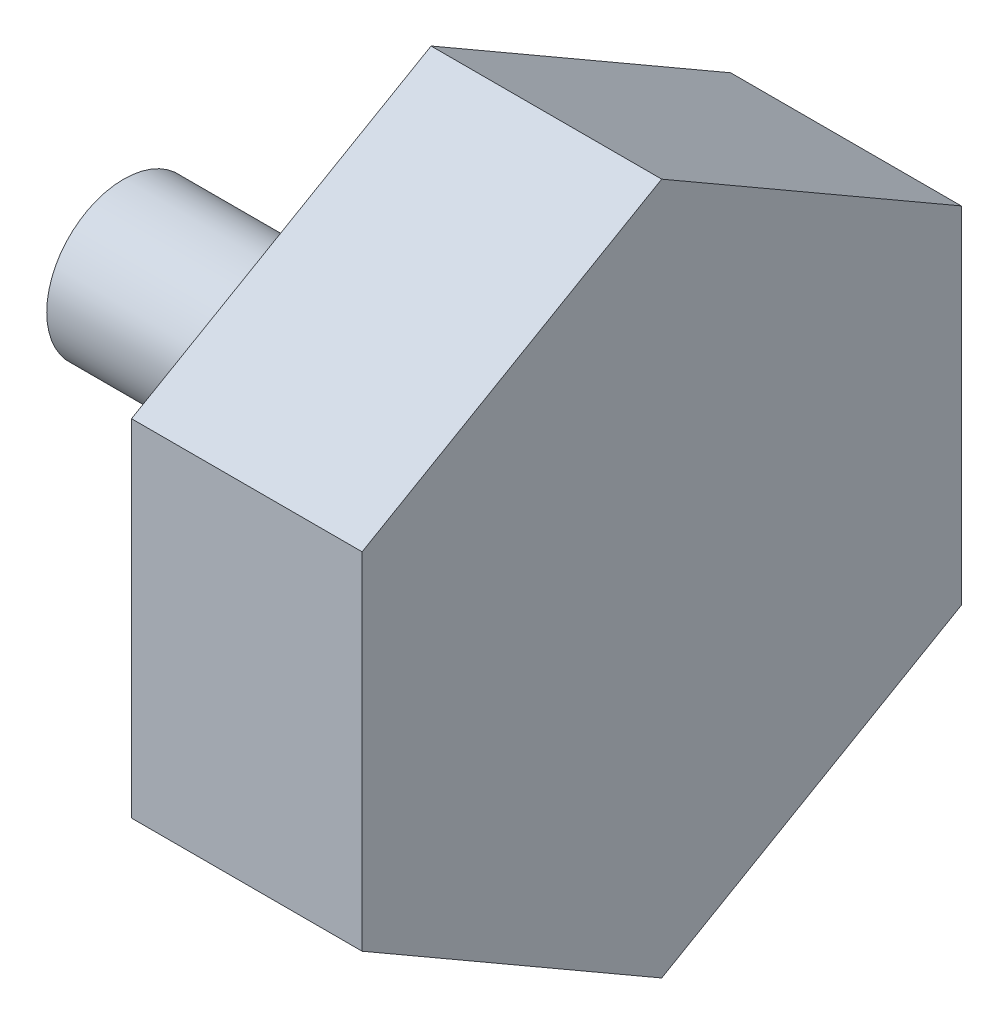
from build123d import *

# Parameters (mm, degrees)
BOSS_EXTRUDE1_DEPTH = 6
SKETCH2_R           = 2
BOSS_EXTRUDE2_DEPTH = 8


with BuildPart() as part:
    # Sketch1 → Boss-Extrude1 (new body)
    with BuildSketch(Plane(origin=(0, 0, 0), x_dir=(0, 0, -1), z_dir=(1, 0, 0))):
        Polygon((0, -9), (7.794228634, -4.5), (7.794228634, 4.5), (0, 9), (-7.794228634, 4.5), (-7.794228634, -4.5), align=None)
    extrude(amount=BOSS_EXTRUDE1_DEPTH)

    # Sketch2 → Boss-Extrude2 (add)
    with BuildSketch(Plane.ZY):
        with Locations(Location((0, 0, 0), (0, 0, 180))):
            Circle(SKETCH2_R)
    extrude(amount=BOSS_EXTRUDE2_DEPTH)


solid = part.part
